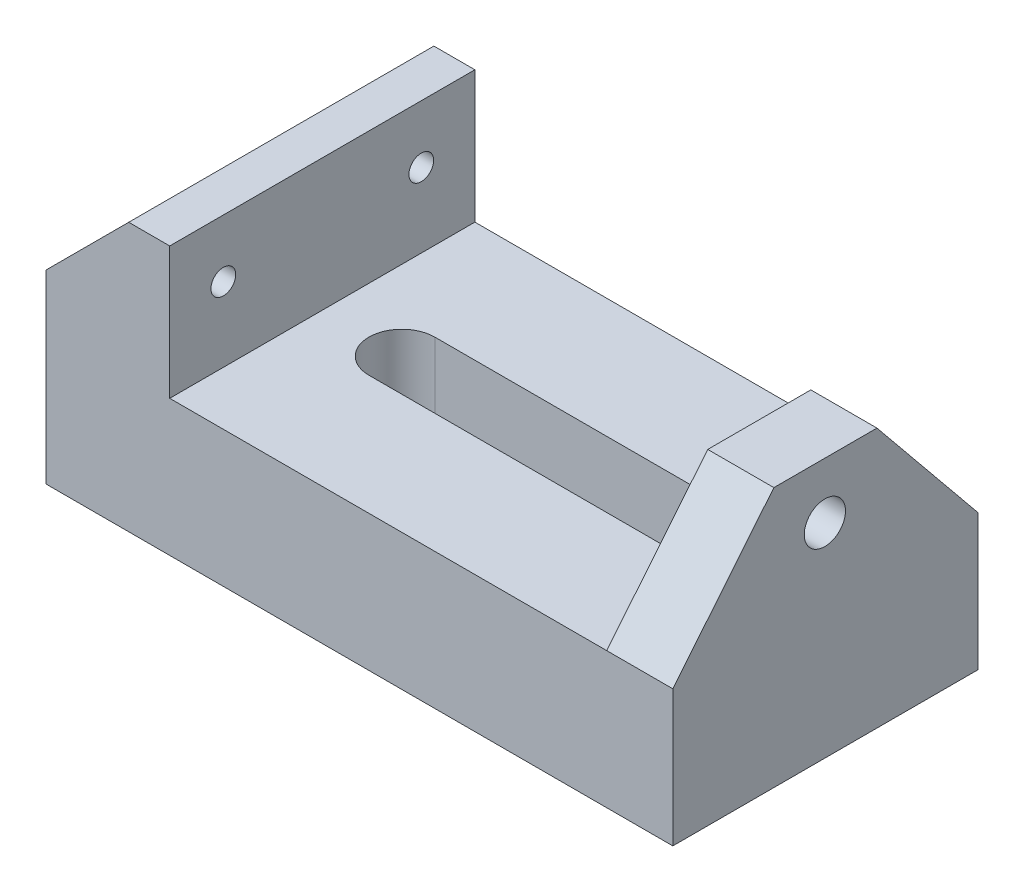
from build123d import *

# Parameters (mm, degrees)
BOSS_EXTRUDE3_DEPTH = 74
CUT_EXTRUDE5_DEPTH  = 74
SKETCH14_R          = 3
CUT_EXTRUDE6_DEPTH  = 74
SKETCH15_R          = 8
CUT_EXTRUDE7_DEPTH  = 13
CUT_EXTRUDE8_DEPTH  = 90
CUT_EXTRUDE10_DEPTH = 22
SKETCH20_R          = 5
CUT_EXTRUDE11_DEPTH = 22


with BuildPart() as part:
    # Sketch2 → Boss-Extrude3 (new body)
    with BuildSketch(Plane.XY):
        Polygon((0, 0), (0, 30), (16.036697248, 30), (16.036697248, -33), (-135.963302752, -33), (-135.963302752, 18), (-135.963302752, 32), (-115.963302752, 32), (-105.963302752, 32), (-105.963302752, 0), align=None)
    extrude(amount=BOSS_EXTRUDE3_DEPTH)

    # Sketch11 → Cut-Extrude5 (cut)
    with BuildSketch(Plane.XY.offset(74)):
        Polygon((-135.963302752, 11.943655514), (-135.963302752, 32), (-115.906958266, 32), align=None)
    extrude(amount=-CUT_EXTRUDE5_DEPTH, mode=Mode.SUBTRACT)

    # Sketch14 → Cut-Extrude6 (cut)
    with BuildSketch(Plane(origin=(-105.963302752, 0, 0), x_dir=(0, 0, -1), z_dir=(1, 0, 0))):
        with Locations((-61, 18)):
            Circle(SKETCH14_R)
        with Locations((-13, 18)):
            Circle(SKETCH14_R)
    extrude(amount=-CUT_EXTRUDE6_DEPTH, mode=Mode.SUBTRACT)

    # Sketch15 → Cut-Extrude7 (cut)
    with BuildSketch(Plane.ZY.offset(135.963302752)):
        with Locations((36.610721791, -4.86425639)):
            Circle(SKETCH15_R)
    extrude(amount=-CUT_EXTRUDE7_DEPTH, mode=Mode.SUBTRACT)

    # Sketch16 → Cut-Extrude8 (cut)
    with BuildSketch(Plane(origin=(0, 0, 0), x_dir=(1, 0, 0), z_dir=(0, 1, 0))):
        with BuildLine():
            Line((-86.67307708, -29), (-8.67307708, -29))
            ThreePointArc((-8.67307708, -29), (-0.67307708, -37), (-8.67307708, -45))
            Line((-8.67307708, -45), (-86.67307708, -45))
            ThreePointArc((-86.67307708, -45), (-94.67307708, -37), (-86.67307708, -29))
        make_face()
    extrude(amount=-CUT_EXTRUDE8_DEPTH, mode=Mode.SUBTRACT)

    # Sketch19 → Cut-Extrude10 (cut)
    with BuildSketch(Plane(origin=(16.036697248, 0, 0), x_dir=(0, 0, -1), z_dir=(1, 0, 0))):
        Polygon((-74, 30), (-74, 0), (-49.5, 30), align=None)
        Polygon((0, 0), (0, 30), (-24.5, 30), align=None)
    extrude(amount=-CUT_EXTRUDE10_DEPTH, mode=Mode.SUBTRACT)

    # Sketch20 → Cut-Extrude11 (cut)
    with BuildSketch(Plane(origin=(16.036697248, 0, 0), x_dir=(0, 0, -1), z_dir=(1, 0, 0))):
        with Locations(Location((-37.135567798, 16.44, 0), (0, 0, 90))):
            Circle(SKETCH20_R)
    extrude(amount=-CUT_EXTRUDE11_DEPTH, mode=Mode.SUBTRACT)


solid = part.part
